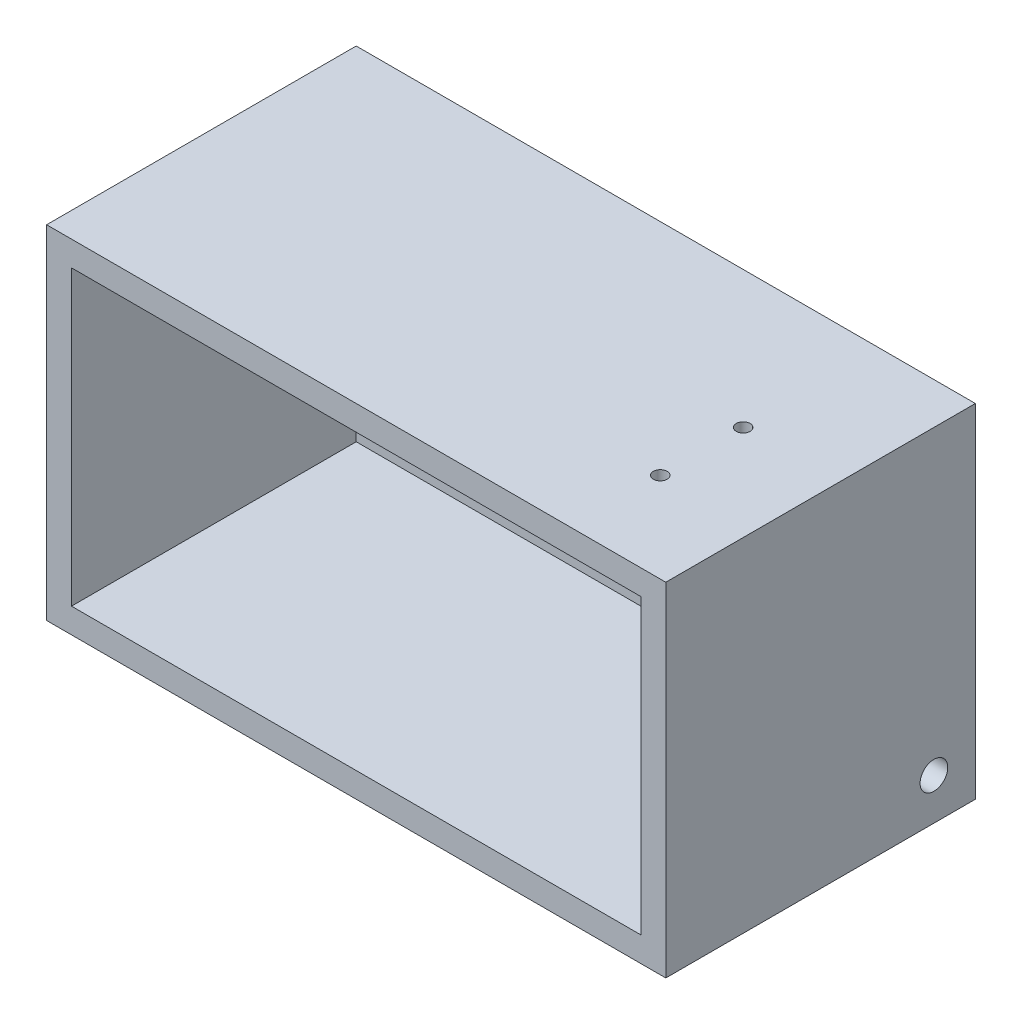
from build123d import *

# Parameters (mm, degrees)
SKETCH1_W                    = 448
SKETCH1_H                    = 248
TAO_KHOI_DEPTH               = 112
SKETCH2_W                    = 412
SKETCH2_H                    = 212
TAO_VUNG_DAT_VO_TRONG_DEPTH  = 206
TAO_LO_DI_DAY_RA_NGOAI_REACH = 526.168
SKETCH3_R                    = 10
SKETCH5_R                    = 5
TAO_LO_LAY_KHI_DEPTH         = 18


with BuildPart() as part:
    # Sketch1 → tao_khoi (new, symmetric)
    with BuildSketch(Plane.XY):
        with Locations((224, 124)):
            Rectangle(SKETCH1_W, SKETCH1_H)
    extrude(amount=TAO_KHOI_DEPTH, both=True)

    # Sketch2 → tao_vung_dat_vo_trong (cut)
    with BuildSketch(Plane.XY.offset(112)):
        with Locations((224, 124)):
            Rectangle(SKETCH2_W, SKETCH2_H)
    extrude(amount=-TAO_VUNG_DAT_VO_TRONG_DEPTH, mode=Mode.SUBTRACT)

    # Sketch3 → tao_lo_di_day_ra_ngoai (cut, up to next)
    with BuildSketch(Plane(origin=(448, 0, 0), x_dir=(0, 0, -1), z_dir=(1, 0, 0)), mode=Mode.PRIVATE) as tao_lo_di_day_ra_ngoai_sk1:
        with Locations((82, 30)):
            Circle(SKETCH3_R)
    tao_lo_di_day_ra_ngoai_tool1 = extrude(tao_lo_di_day_ra_ngoai_sk1.sketch, amount=-TAO_LO_DI_DAY_RA_NGOAI_REACH, mode=Mode.PRIVATE) & part.part
    add(tao_lo_di_day_ra_ngoai_tool1.solids().sort_by_distance((448, 30, -82))[0], mode=Mode.SUBTRACT)

    # Sketch5 → tao_lo_lay_khi (cut)
    with BuildSketch(Plane(origin=(0, 248, 0), x_dir=(1, 0, 0), z_dir=(0, 1, 0))):
        with Locations(Location((379, 13, 0), (0, 0, 270))):
            Circle(SKETCH5_R)
        with Locations(Location((379, -47, 0), (0, 0, 270))):
            Circle(SKETCH5_R)
    extrude(amount=-TAO_LO_LAY_KHI_DEPTH, mode=Mode.SUBTRACT)


solid = part.part
